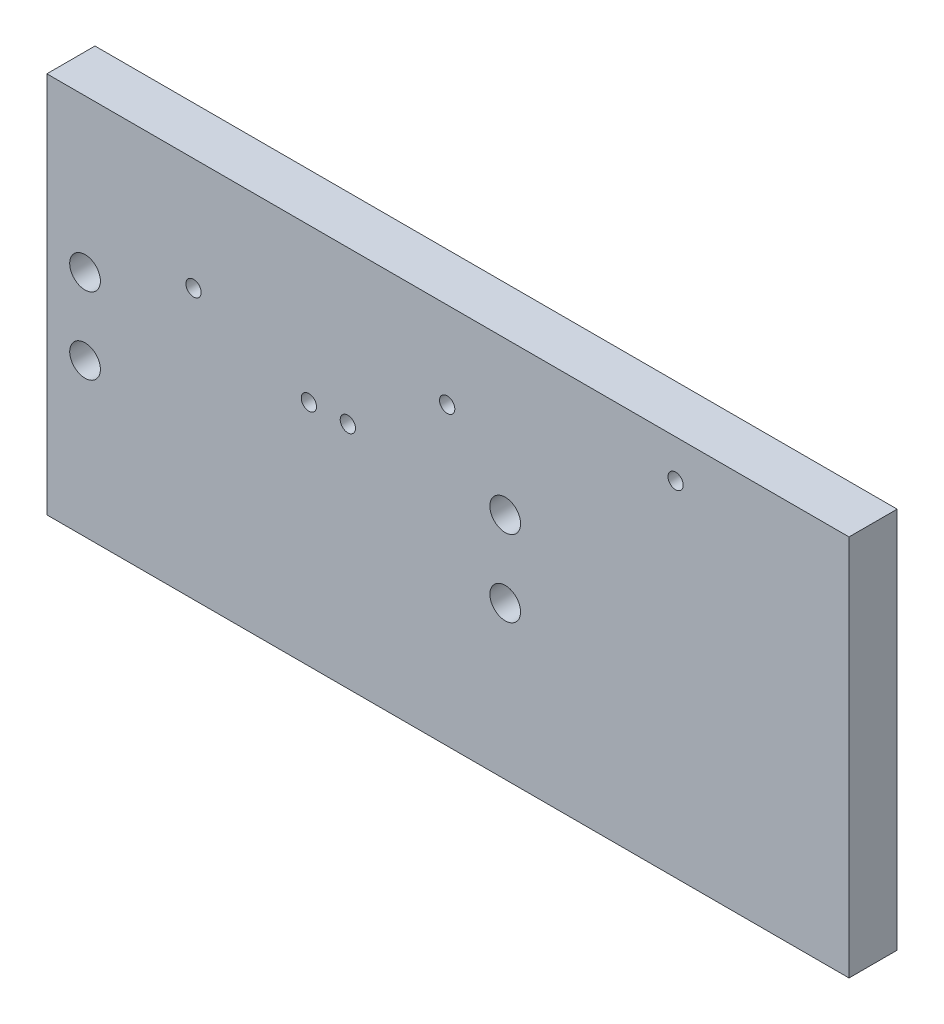
from build123d import *

# Parameters (mm, degrees)
SKETCH1_W           = 26.67
SKETCH1_H           = 12.7
BOARD_OUTLINE_DEPTH = 1.6
SKETCH2_R           = 0.254
NPTH_DEPTH          = 30.582746661
SKETCH3_R           = 0.51
PTH_DEPTH           = 30.582746661


with BuildPart() as part:
    # Sketch1 → Board_Outline (new body)
    with BuildSketch(Plane.XY):
        with Locations((13.335, 6.35)):
            Rectangle(SKETCH1_W, SKETCH1_H)
    extrude(amount=BOARD_OUTLINE_DEPTH)

    # Sketch2 → NPTH (cut, through all)
    with BuildSketch(Plane.XY):
        with Locations((8.7122, 7.5946)):
            Circle(SKETCH2_R)
        with Locations((10.0076, 7.62)):
            Circle(SKETCH2_R)
        with Locations((13.3096, 9.8298)):
            Circle(SKETCH2_R)
        with Locations((20.9042, 11.43)):
            Circle(SKETCH2_R)
        with Locations((4.8768, 8.9662)):
            Circle(SKETCH2_R)
    extrude(amount=NPTH_DEPTH, mode=Mode.SUBTRACT)

    # Sketch3 → PTH (cut, through all)
    with BuildSketch(Plane.XY):
        with Locations((1.27, 7.62)):
            Circle(SKETCH3_R)
        with Locations((1.27, 5.08)):
            Circle(SKETCH3_R)
        with Locations((15.24, 7.62)):
            Circle(SKETCH3_R)
        with Locations((15.24, 5.08)):
            Circle(SKETCH3_R)
    extrude(amount=PTH_DEPTH, mode=Mode.SUBTRACT)


solid = part.part
